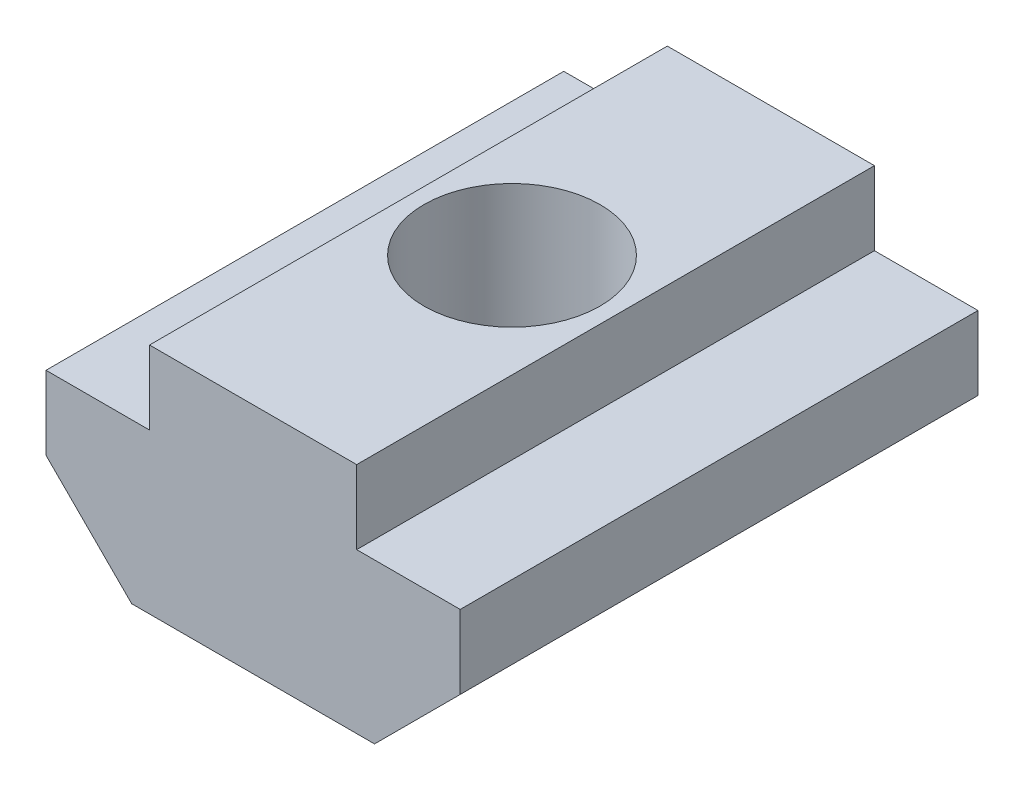
from build123d import *

# Parameters (mm, degrees)
EXTRUSION1_DEPTH = 20
HOLE2_D          = 6.8


with BuildPart() as part:
    # Sketch1 → Extrusion1 (new body)
    with BuildSketch(Plane.XY):
        Polygon((2.963546137, 0.389938146), (-0.346853863, 3.700338146), (-0.346853863, 6.545138146), (3.652646137, 6.545138146), (3.652646137, 9.389938146), (11.653646137, 9.389938146), (11.653646137, 6.545138146), (15.653146137, 6.545138146), (15.653146137, 3.700338146), (12.342746137, 0.389938146), align=None)
    extrude(amount=EXTRUSION1_DEPTH)

    # Hole2 (through all)
    with Locations(Plane.XZ.offset(-0.389938146)):
        with Locations((7.653146137, 10)):
            Hole(HOLE2_D / 2)


solid = part.part
